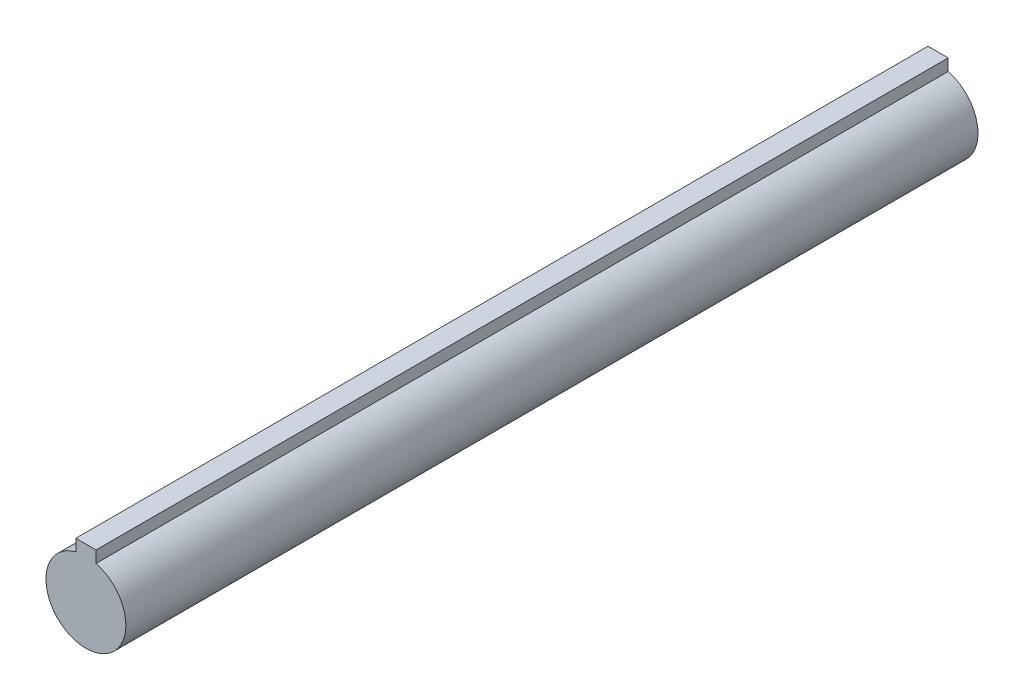
from build123d import *

# Parameters (mm, degrees)
BOSS_EXTRUDE1_DEPTH = 203.2


with BuildPart() as part:
    # Sketch1 → Boss-Extrude1 (new body)
    with BuildSketch(Plane.XY):
        with BuildLine():
            Line((-2.413, 9.214285431), (-2.413, 12.008285431))
            Line((-2.413, 12.008285431), (2.413, 12.008285431))
            Line((2.413, 12.008285431), (2.413, 9.214285431))
            ThreePointArc((2.413, 9.214285431), (0, -9.525), (-2.413, 9.214285431))
        make_face()
    extrude(amount=BOSS_EXTRUDE1_DEPTH)


solid = part.part
